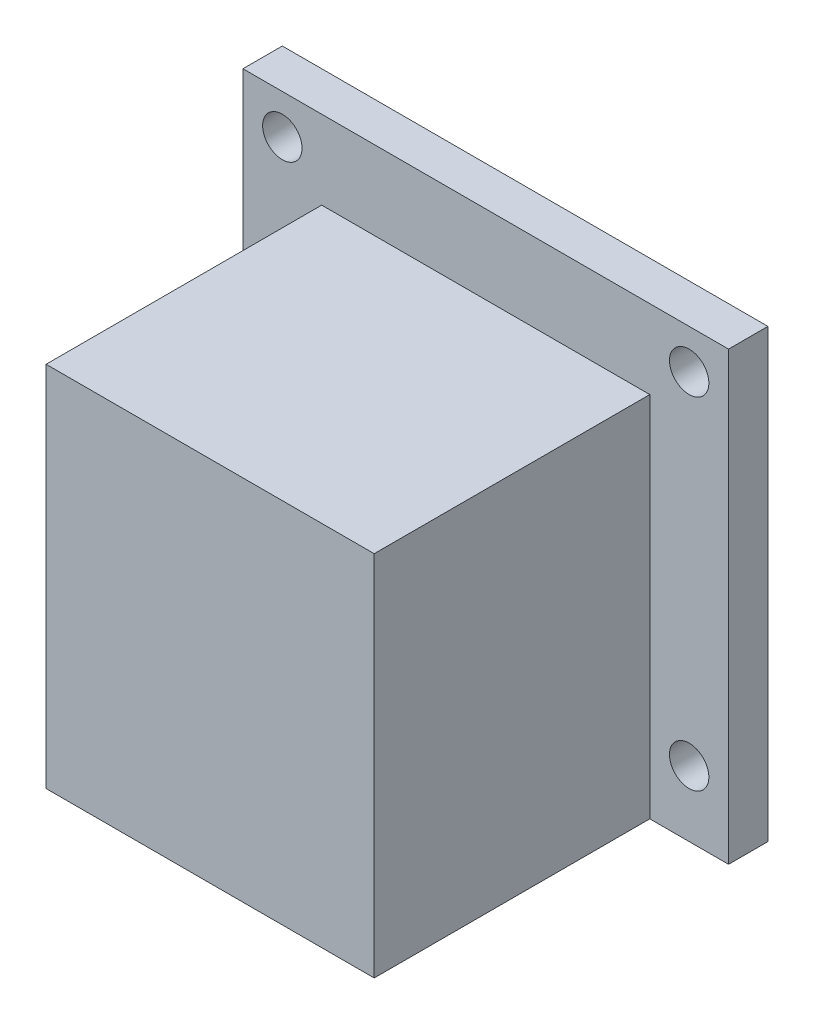
from build123d import *

# Parameters (mm, degrees)
SKETCH_1_W          = 25
SKETCH_1_H          = 25
EXTRUDE_1_DEPTH     = 25
SHELL_2_T           = -2
SKETCH_2_W          = 21
SKETCH_2_H          = 23
CUT_EXTRUDE_1_DEPTH = 25
SKETCH_3_W          = 25
SKETCH_3_H          = 25
EXTRUDE_2_DEPTH     = 3
EXTRUDE_3_DEPTH     = 4
CUT_EXTRUDE_2_DEPTH = 1
SKETCH_7_R          = 1.5
CUT_EXTRUDE_3_DEPTH = 46.543934832


with BuildPart() as part:
    # 草图1 → 凸台-拉伸1 (new body)
    with BuildSketch(Plane(origin=(0, 0, 0), x_dir=(1, 0, 0), z_dir=(0, 1, 0))):
        Rectangle(SKETCH_1_W, SKETCH_1_H)
    extrude(amount=EXTRUDE_1_DEPTH)

    # 抽壳2
    shell_2_openings = [part.faces().sort_by_distance(p)[0] for p in [
        (0, 12.5, -12.5),
    ]]
    offset(amount=SHELL_2_T, openings=shell_2_openings, kind=Kind.INTERSECTION)

    # 草图2 → 切除-拉伸1 (cut)
    with BuildSketch(Plane(origin=(0, 2, 0), x_dir=(1, 0, 0), z_dir=(0, 1, 0))):
        with Locations((0, 1)):
            Rectangle(SKETCH_2_W, SKETCH_2_H)
    extrude(amount=-CUT_EXTRUDE_1_DEPTH, mode=Mode.SUBTRACT)

    # 草图3 → 凸台-拉伸2 (add)
    with BuildSketch(Plane(origin=(0, 25, 0), x_dir=(1, 0, 0), z_dir=(0, 1, 0))):
        Rectangle(SKETCH_3_W, SKETCH_3_H)
    extrude(amount=EXTRUDE_2_DEPTH)

    # 草图5 → 凸台-拉伸3 (add)
    with BuildSketch(Plane(origin=(0, 0, -12.5), x_dir=(-1, 0, 0), z_dir=(0, 0, -1))):
        Polygon((18.5, 0), (18.5, 34), (-18.5, 34), (-18.5, 0), (-12.5, 0), (-12.5, 28), (12.5, 28), (12.5, 0), align=None)
    extrude(amount=-EXTRUDE_3_DEPTH)

    # 草图6 → 切除-拉伸2 (cut)
    with BuildSketch(Plane(origin=(0, 0, -12.5), x_dir=(-1, 0, 0), z_dir=(0, 0, -1))):
        Polygon((10.5, 0), (18.5, 0), (18.5, 34), (-18.5, 34), (-18.5, 0), (-10.5, 0), (-10.5, 23), (10.5, 23), align=None)
    extrude(amount=-CUT_EXTRUDE_2_DEPTH, mode=Mode.SUBTRACT)

    # 草图7 → 切除-拉伸3 (cut, through all)
    with BuildSketch(Plane(origin=(0, 0, -11.5), x_dir=(-1, 0, 0), z_dir=(0, 0, -1))):
        with Locations((-15.5, 5)):
            Circle(SKETCH_7_R)
        with Locations((-15.5, 31)):
            Circle(SKETCH_7_R)
        with Locations((15.5, 5)):
            Circle(SKETCH_7_R)
        with Locations((15.5, 31)):
            Circle(SKETCH_7_R)
    extrude(amount=-CUT_EXTRUDE_3_DEPTH, mode=Mode.SUBTRACT)


solid = part.part
